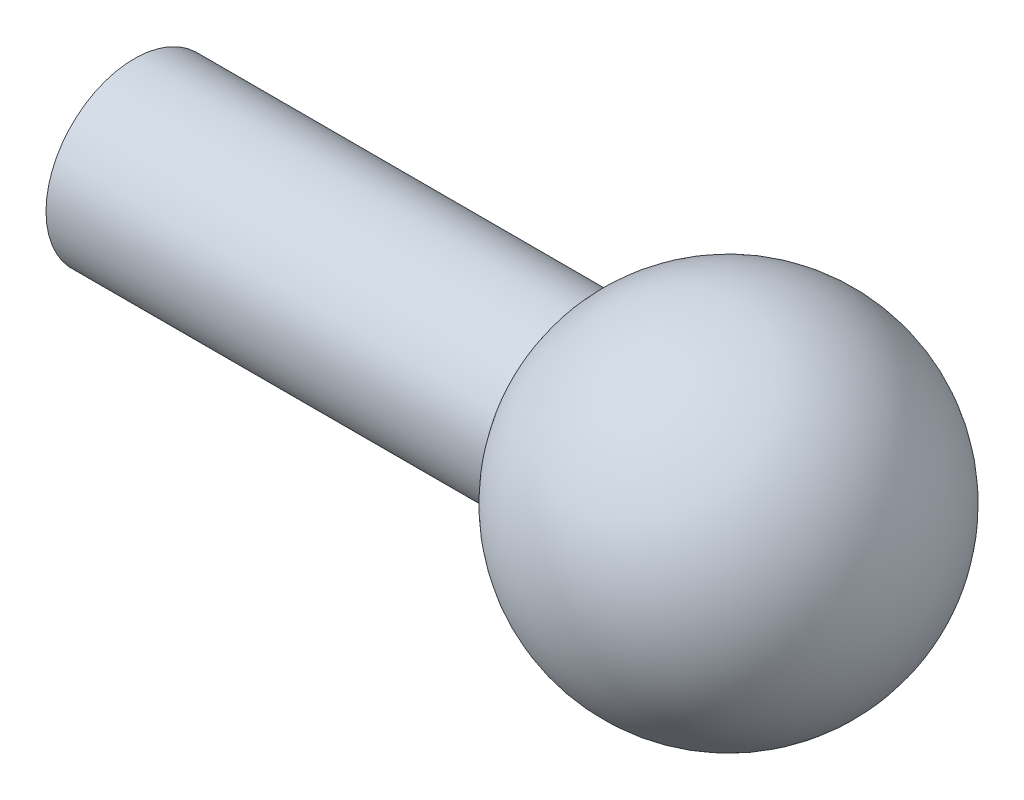
from build123d import *


with BuildPart() as part:
    # Sketch1 → Revolve1 (revolve)
    with BuildSketch(Plane(origin=(0, 0, 0), x_dir=(1, 0, 0), z_dir=(0, 1, 0))):
        with BuildLine():
            Line((-6.35, 0), (15.829409051, 0))
            ThreePointArc((15.829409051, 0), (12.0642098, 4.906903198), (6.35, 2.54))
            Line((6.35, 2.54), (-6.35, 2.54))
            Line((-6.35, 2.54), (-6.35, 0))
        make_face()
    revolve(axis=Axis((-6.35, 0, 0), (1, 0, 0)))


solid = part.part
